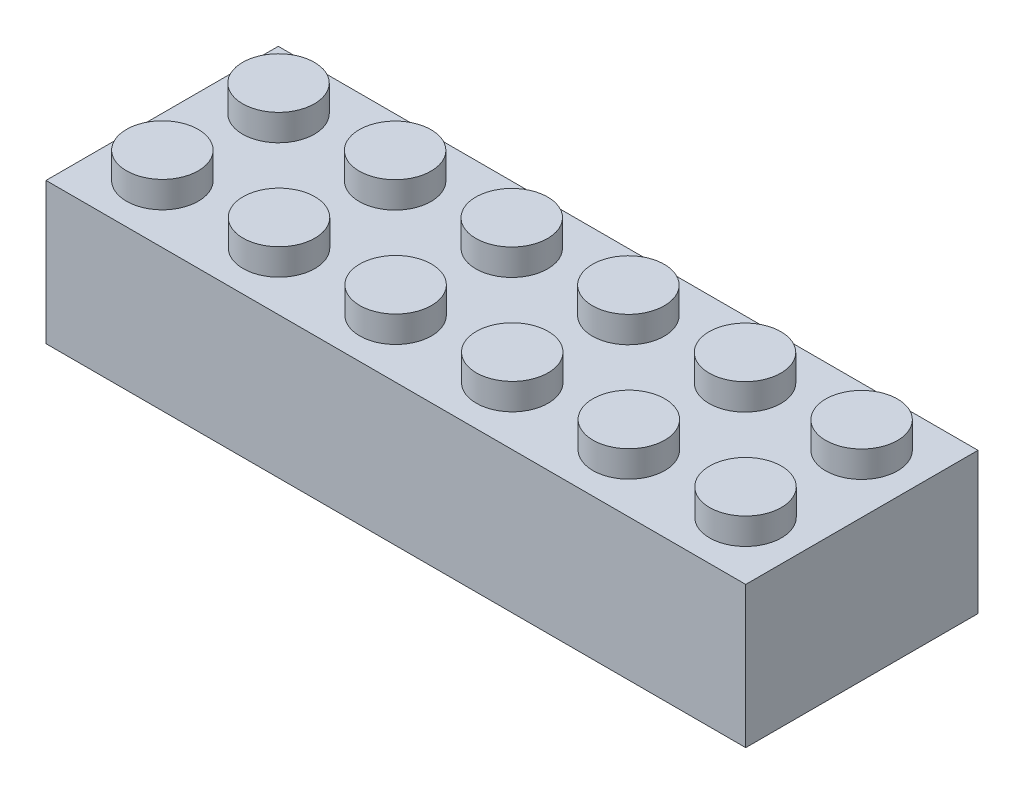
from build123d import *

# Parameters (mm, degrees)
SKETCH1_W           = 47.75
SKETCH1_H           = 15.85
BOSS_EXTRUDE1_DEPTH = 9.65
SKETCH2_R           = 2.45
BOSS_EXTRUDE2_DEPTH = 1.8
SHELL1_T            = -1.2
SKETCH3_R           = 3.25
SKETCH3_R_2         = 2.33
BOSS_EXTRUDE3_DEPTH = 8.25


with BuildPart() as part:
    # Sketch1 → Boss-Extrude1 (new body)
    with BuildSketch(Plane(origin=(0, 0, 0), x_dir=(1, 0, 0), z_dir=(0, 1, 0))):
        Rectangle(SKETCH1_W, SKETCH1_H)
    extrude(amount=-BOSS_EXTRUDE1_DEPTH)

    # Sketch2 → Boss-Extrude2 (add)
    with BuildSketch(Plane(origin=(0, 0, 0), x_dir=(1, 0, 0), z_dir=(0, 1, 0))):
        with Locations(Location((-19.895833333, 3.9625, 0), (0, 0, 270))):
            Circle(SKETCH2_R)
        with Locations(Location((-11.9375, 3.9625, 0), (0, 0, 270))):
            Circle(SKETCH2_R)
        with Locations(Location((-3.979166667, 3.9625, 0), (0, 0, 270))):
            Circle(SKETCH2_R)
        with Locations(Location((3.979166667, 3.9625, 0), (0, 0, 270))):
            Circle(SKETCH2_R)
        with Locations(Location((11.9375, 3.9625, 0), (0, 0, 270))):
            Circle(SKETCH2_R)
        with Locations(Location((19.895833333, 3.9625, 0), (0, 0, 270))):
            Circle(SKETCH2_R)
        with Locations(Location((-11.9375, -3.9625, 0), (0, 0, 270))):
            Circle(SKETCH2_R)
        with Locations(Location((-3.979166667, -3.9625, 0), (0, 0, 270))):
            Circle(SKETCH2_R)
        with Locations(Location((3.979166667, -3.9625, 0), (0, 0, 270))):
            Circle(SKETCH2_R)
        with Locations(Location((11.9375, -3.9625, 0), (0, 0, 270))):
            Circle(SKETCH2_R)
        with Locations(Location((19.895833333, -3.9625, 0), (0, 0, 270))):
            Circle(SKETCH2_R)
        with Locations(Location((-19.895833333, -3.9625, 0), (0, 0, 270))):
            Circle(SKETCH2_R)
    extrude(amount=BOSS_EXTRUDE2_DEPTH)

    # Shell1
    shell1_openings = [part.faces().sort_by_distance(p)[0] for p in [
        (0, -9.65, 0),
    ]]
    offset(amount=SHELL1_T, openings=shell1_openings, kind=Kind.INTERSECTION)

    # Sketch3 → Boss-Extrude3 (add)
    # profile 1 of 5: a face of its own
    with BuildSketch(Plane.XZ.offset(1.2)):
        with Locations(Location((-15.916666667, 0, 0), (0, 0, 90))):
            Circle(SKETCH3_R)
        with Locations(Location((-15.916666667, 0, 0), (0, 0, 90))):
            Circle(SKETCH3_R_2, mode=Mode.SUBTRACT)
    # profile 2 of 5: a face of its own
    with BuildSketch(Plane.XZ.offset(1.2)):
        with Locations(Location((-7.958333333, 0, 0), (0, 0, 90))):
            Circle(SKETCH3_R)
        with Locations(Location((-7.958333333, 0, 0), (0, 0, 90))):
            Circle(SKETCH3_R_2, mode=Mode.SUBTRACT)
    # profile 3 of 5: a face of its own
    with BuildSketch(Plane.XZ.offset(1.2)):
        with Locations(Location((0, 0, 0), (0, 0, 90))):
            Circle(SKETCH3_R)
        with Locations(Location((0, 0, 0), (0, 0, 90))):
            Circle(SKETCH3_R_2, mode=Mode.SUBTRACT)
    # profile 4 of 5: a face of its own
    with BuildSketch(Plane.XZ.offset(1.2)):
        with Locations(Location((7.958333333, 0, 0), (0, 0, 90))):
            Circle(SKETCH3_R)
        with Locations(Location((7.958333333, 0, 0), (0, 0, 90))):
            Circle(SKETCH3_R_2, mode=Mode.SUBTRACT)
    # profile 5 of 5: a face of its own
    with BuildSketch(Plane.XZ.offset(1.2)):
        with Locations(Location((15.916666667, 0, 0), (0, 0, 90))):
            Circle(SKETCH3_R)
        with Locations(Location((15.916666667, 0, 0), (0, 0, 90))):
            Circle(SKETCH3_R_2, mode=Mode.SUBTRACT)
    extrude(amount=BOSS_EXTRUDE3_DEPTH)


solid = part.part
